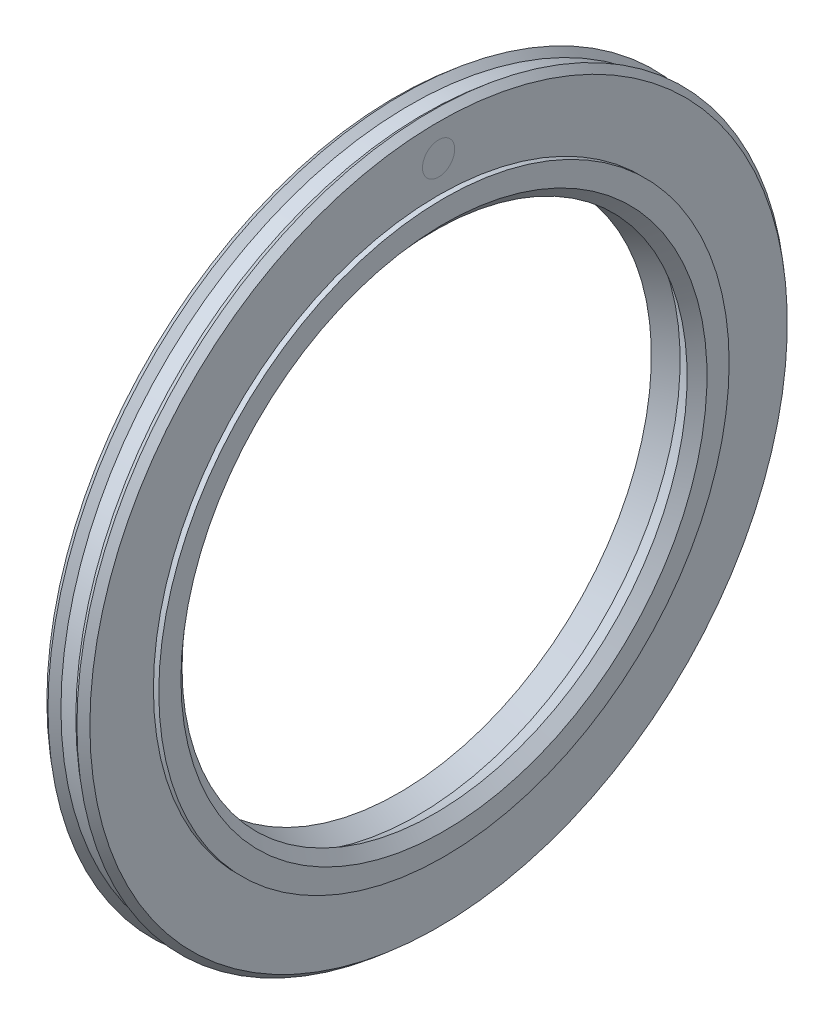
from build123d import *

# Parameters (mm, degrees)
ESQUISSE2_R                  = 1
ENL_V_MAT_EXTRU_1_DEPTH      = 0.5
R_P_TITION_CIRCULAIRE1_COUNT = 6
ESQUISSE5_R                  = 0.5
ENL_V_MAT_EXTRU_2_DEPTH      = 0.5


with BuildPart() as part:
    # Esquisse1 → Base-Révolution (revolve)
    with BuildSketch(Plane.XY):
        Polygon((0, 32.449656843), (0.653785579, 33), (1.307571158, 32.449656843), (2.692428842, 32.449656843), (3.346214421, 33), (4, 32.449656843), (4, 26.537069046), (4.5, 26.537069046), (4.5, 24.475834219), (3.627749385, 23.5), (2, 24.475834219), (0.3, 23.5), (0.5, 24.793358266), (0.5, 26.537069046), (0, 26.537069046), align=None)
    revolve(axis=Axis((0, 0, 0), (1, 0, 0)))

    # Esquisse2 → Enlèv. mat.-Extru.1 (cut)
    with BuildSketch(Plane.ZY):
        with Locations((0, 29.5)):
            Circle(ESQUISSE2_R)
    enl_v_mat_extru_1 = extrude(amount=-ENL_V_MAT_EXTRU_1_DEPTH, mode=Mode.SUBTRACT)

    # Répétition circulaire1: Enlèv. mat.-Extru.1 ×6 about axis
    r_p_tition_circulaire1_axis = Axis((-2.3625, 0, 0), (1, 0, 0))
    for i in range(1, R_P_TITION_CIRCULAIRE1_COUNT):
        add(enl_v_mat_extru_1.rotate(r_p_tition_circulaire1_axis, i * 360 / R_P_TITION_CIRCULAIRE1_COUNT), mode=Mode.SUBTRACT)

    # Esquisse5 → Enlèv. mat.-Extru.2 (cut)
    with BuildSketch(Plane.ZY):
        with Locations((31, 0)):
            Circle(ESQUISSE5_R)
        with Locations((28, 0)):
            Circle(ESQUISSE5_R)
    extrude(amount=-ENL_V_MAT_EXTRU_2_DEPTH, mode=Mode.SUBTRACT)


solid = part.part
